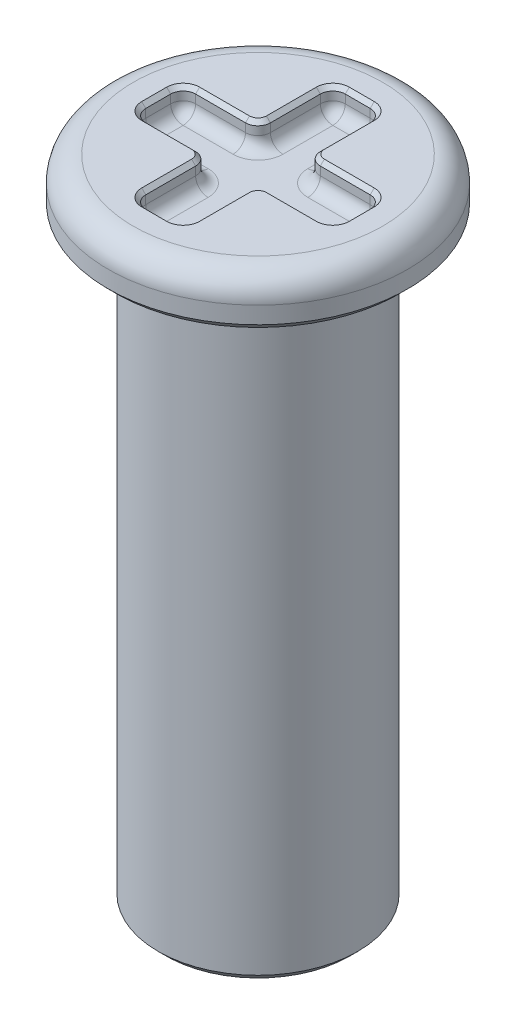
from build123d import *

# Parameters (mm, degrees)
CUT_EXTRUDE1_DEPTH = 0.79375
FILLET1_R          = 0.79375
FILLET2_R          = 0.396875
CHAMFER1_SIZE      = 0.254
CHAMFER2_SIZE      = 0.127


with BuildPart() as part:
    # Sketch1 → Revolve1 (revolve)
    with BuildSketch(Plane.XY, mode=Mode.PRIVATE) as revolve1_sk:
        Polygon((2.38125, 0), (3.175, 0), (3.175, 19.05), (4.7625, 19.05), (4.7625, 20.6375), (0, 20.6375), (0, 19.05), (2.38125, 19.05), align=None)
    revolve(revolve1_sk.sketch.rotate(Axis((0, 3.655427632, 0), (0, -1, 0)), 180), axis=Axis((0, 3.655427632, 0), (0, -1, 0)))

    # Sketch2 → Cut-Extrude1 (cut)
    with BuildSketch(Plane(origin=(0, 20.6375, 0), x_dir=(1, 0, 0), z_dir=(0, 1, 0))):
        Polygon((-3.175, 0.79375), (-3.175, -0.79375), (-0.79375, -0.79375), (-0.79375, -3.175), (0.79375, -3.175), (0.79375, -0.79375), (3.175, -0.79375), (3.175, 0.79375), (0.79375, 0.79375), (0.79375, 3.175), (-0.79375, 3.175), (-0.79375, 0.79375), align=None)
    extrude(amount=-CUT_EXTRUDE1_DEPTH, mode=Mode.SUBTRACT)

    # Fillet1
    fillet1_edges = [part.edges().sort_by_distance(p)[0] for p in [
        (4.7625, 20.6375, 0),
        (3.175, 19.05, 0),
    ]]
    fillet(fillet1_edges, radius=FILLET1_R)

    # Fillet2
    fillet2_edges = [part.edges().sort_by_distance(p)[0] for p in [
        (0, 19.84375, -3.175),
        (-0.79375, 20.240625, -3.175),
        (0.79375, 19.84375, -1.984375),
        (0.79375, 20.240625, -3.175),
        (1.984375, 19.84375, -0.79375),
        (0.79375, 20.240625, -0.79375),
        (3.175, 19.84375, 0),
        (3.175, 20.240625, -0.79375),
        (1.984375, 19.84375, 0.79375),
        (3.175, 20.240625, 0.79375),
        (0.79375, 19.84375, 1.984375),
        (0.79375, 20.240625, 0.79375),
        (0, 19.84375, 3.175),
        (0.79375, 20.240625, 3.175),
        (-0.79375, 19.84375, 1.984375),
        (-0.79375, 20.240625, 3.175),
        (-1.984375, 19.84375, 0.79375),
        (-0.79375, 20.240625, 0.79375),
        (-3.175, 19.84375, 0),
        (-3.175, 20.240625, 0.79375),
        (-1.984375, 19.84375, -0.79375),
        (-3.175, 20.240625, -0.79375),
        (-0.79375, 19.84375, -1.984375),
        (-0.79375, 20.240625, -0.79375),
        (2.38125, 19.05, 0),
    ]]
    fillet(fillet2_edges, radius=FILLET2_R)

    # Chamfer1
    chamfer1_edges = [part.edges().sort_by_distance(p)[0] for p in [
        (4.7625, 19.05, 0),
        (3.175, 0, 0),
        (2.38125, 0, 0),
    ]]
    chamfer(chamfer1_edges, length=CHAMFER1_SIZE)

    # Chamfer2
    chamfer2_edges = [part.edges().sort_by_distance(p)[0] for p in [
        (0, 20.6375, -3.175),
        (-0.79375, 20.6375, -1.984375),
        (-3.175, 20.6375, 0),
        (-1.984375, 20.6375, 0.79375),
        (-0.79375, 20.6375, 1.984375),
        (0, 20.6375, 3.175),
        (0.79375, 20.6375, 1.984375),
        (1.984375, 20.6375, 0.79375),
        (3.175, 20.6375, 0),
        (1.984375, 20.6375, -0.79375),
        (0.79375, 20.6375, -1.984375),
        (-1.984375, 20.6375, -0.79375),
        (0.909991996, 20.6375, -0.909991996),
        (0.909991996, 20.6375, 0.909991996),
        (-0.909991996, 20.6375, 0.909991996),
        (-0.909991996, 20.6375, -0.909991996),
        (-0.677508004, 20.6375, -3.058758004),
        (-3.058758004, 20.6375, -0.677508004),
        (-3.058758004, 20.6375, 0.677508004),
        (-0.677508004, 20.6375, 3.058758004),
        (0.677508004, 20.6375, 3.058758004),
        (3.058758004, 20.6375, 0.677508004),
        (3.058758004, 20.6375, -0.677508004),
        (0.677508004, 20.6375, -3.058758004),
    ]]
    chamfer(chamfer2_edges, length=CHAMFER2_SIZE)


solid = part.part
